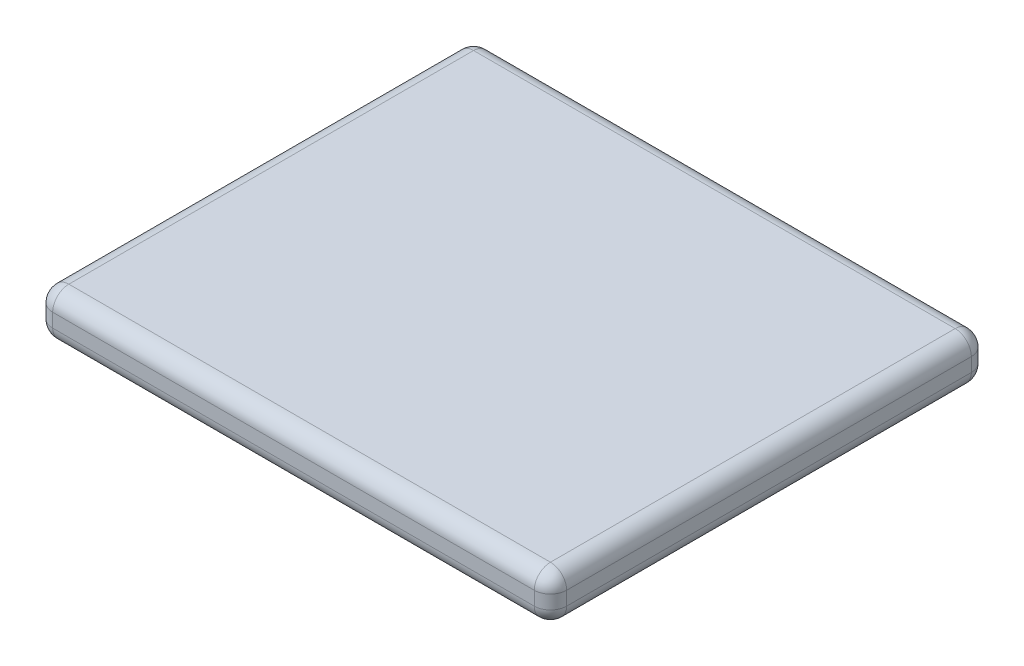
from build123d import *

# Parameters (mm, degrees)
SKETCH1_W           = 63.5
SKETCH1_H           = 54
BOSS_EXTRUDE1_DEPTH = 5.7
FILLET1_R           = 2


with BuildPart() as part:
    # Sketch1 → Boss-Extrude1 (new body)
    with BuildSketch(Plane(origin=(0, 0, 0), x_dir=(1, 0, 0), z_dir=(0, 1, 0))):
        with Locations((31.75, 27)):
            Rectangle(SKETCH1_W, SKETCH1_H)
    extrude(amount=BOSS_EXTRUDE1_DEPTH)

    # Fillet1
    fillet1_edges = [part.edges().sort_by_distance(p)[0] for p in [
        (63.5, 5.7, -27),
        (31.75, 5.7, -54),
        (0, 5.7, -27),
        (31.75, 0, -54),
        (63.5, 0, -27),
        (31.75, 0, 0),
        (0, 0, -27),
        (0, 2.85, -54),
        (63.5, 2.85, -54),
        (63.5, 2.85, 0),
        (0, 2.85, 0),
        (31.75, 5.7, 0),
    ]]
    fillet(fillet1_edges, radius=FILLET1_R)


solid = part.part
